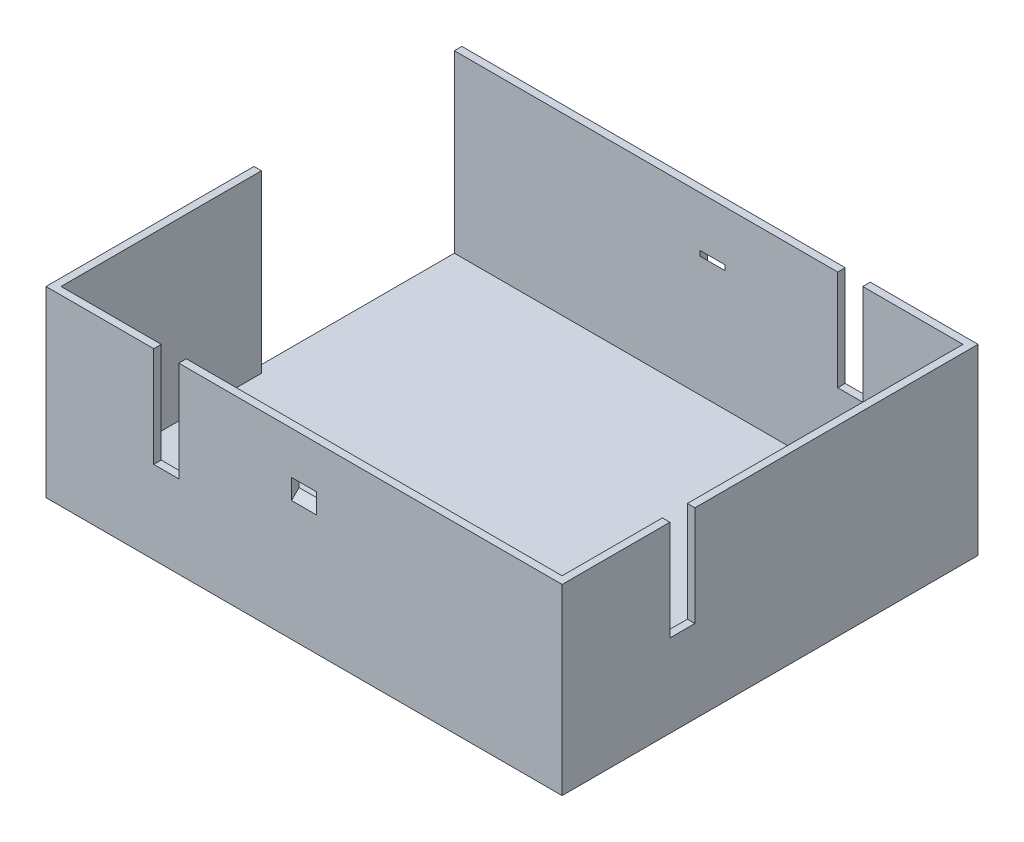
from build123d import *

# Parameters (mm, degrees)
SKETCH1_W           = 103
SKETCH1_H           = 83
BOSS_EXTRUDE1_DEPTH = 1.5
SKETCH2_W           = 103
SKETCH2_H           = 83
SKETCH2_W_2         = 100
SKETCH2_H_2         = 80
BOSS_EXTRUDE2_DEPTH = 35
SKETCH4_W           = 40
SKETCH4_H           = 35
CUT_EXTRUDE2_DEPTH  = 1.5
SKETCH5_W           = 5
SKETCH5_H           = 20
CUT_EXTRUDE3_DEPTH  = 1.5
SKETCH6_W           = 5
SKETCH6_H           = 20
CUT_EXTRUDE4_DEPTH  = 1.5
CUT_EXTRUDE5_DEPTH  = 2.5
SKETCH9_W           = 5
SKETCH9_H           = 20
CUT_EXTRUDE6_DEPTH  = 5


with BuildPart() as part:
    # Sketch1 → Boss-Extrude1 (new body)
    with BuildSketch(Plane(origin=(0, 0, 0), x_dir=(1, 0, 0), z_dir=(0, 1, 0))):
        with Locations((23.028301887, -29.825471698)):
            Rectangle(SKETCH1_W, SKETCH1_H)
    extrude(amount=BOSS_EXTRUDE1_DEPTH)

    # Sketch2 → Boss-Extrude2 (add)
    with BuildSketch(Plane(origin=(0, 1.5, 0), x_dir=(1, 0, 0), z_dir=(0, 1, 0))):
        with Locations((23.028301887, -29.825471698)):
            Rectangle(SKETCH2_W, SKETCH2_H)
        with Locations((23.028301887, -29.825471698)):
            Rectangle(SKETCH2_W_2, SKETCH2_H_2, mode=Mode.SUBTRACT)
    extrude(amount=BOSS_EXTRUDE2_DEPTH)

    # Sketch4 → Cut-Extrude2 (cut)
    with BuildSketch(Plane.ZY.offset(28.471698113)):
        with Locations((9.825471698, 19)):
            Rectangle(SKETCH4_W, SKETCH4_H)
    extrude(amount=-CUT_EXTRUDE2_DEPTH, mode=Mode.SUBTRACT)

    # Sketch5 → Cut-Extrude3 (cut)
    with BuildSketch(Plane.XY.offset(71.325471698)):
        with Locations((-4.471698113, 26.5)):
            Rectangle(SKETCH5_W, SKETCH5_H)
    extrude(amount=-CUT_EXTRUDE3_DEPTH, mode=Mode.SUBTRACT)

    # Sketch6 → Cut-Extrude4 (cut)
    with BuildSketch(Plane(origin=(74.528301887, 0, 0), x_dir=(0, 0, -1), z_dir=(1, 0, 0))):
        with Locations((-47.325471698, 26.5)):
            Rectangle(SKETCH6_W, SKETCH6_H)
    extrude(amount=-CUT_EXTRUDE4_DEPTH, mode=Mode.SUBTRACT)

    # Sketch7 → Cut-Extrude5 (cut, symmetric)
    with BuildSketch(Plane(origin=(23.028301887, 0, 0), x_dir=(0, 0, -1), z_dir=(1, 0, 0))):
        Polygon((-71.325471698, 28), (-69.825471698, 26.5), (-69.825471698, 25.5), (-71.325471698, 24), align=None)
        Polygon((11.674528302, 28), (11.674528302, 24), (10.174528302, 25.5), (10.174528302, 26.5), align=None)
    extrude(amount=CUT_EXTRUDE5_DEPTH, both=True, mode=Mode.SUBTRACT)

    # Sketch9 → Cut-Extrude6 (cut)
    with BuildSketch(Plane(origin=(0, 0, -11.674528302), x_dir=(-1, 0, 0), z_dir=(0, 0, -1))):
        with Locations((-50.528301887, 26.5)):
            Rectangle(SKETCH9_W, SKETCH9_H)
    extrude(amount=-CUT_EXTRUDE6_DEPTH, mode=Mode.SUBTRACT)


solid = part.part
